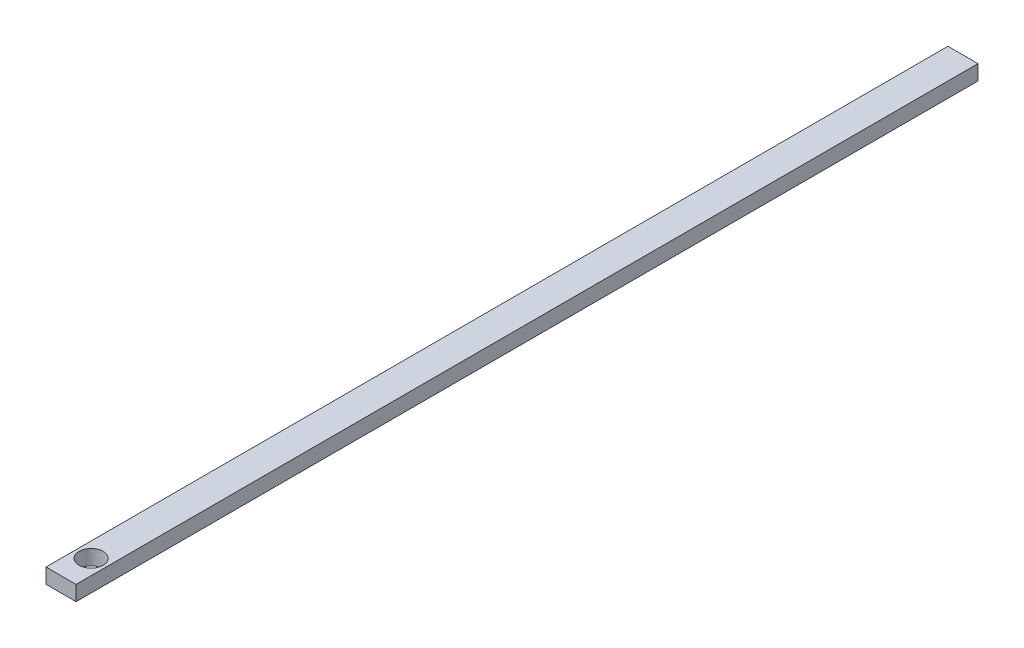
from build123d import *

# Parameters (mm, degrees)
SKETCH1_W           = 300
SKETCH1_H           = 5
BOSS_EXTRUDE1_DEPTH = 10
SKETCH2_R           = 4
CUT_EXTRUDE1_DEPTH  = 151.416089565


with BuildPart() as part:
    # Sketch1 → Boss-Extrude1 (new body)
    with BuildSketch(Plane(origin=(0, 0, 0), x_dir=(0, 0, -1), z_dir=(1, 0, 0))):
        Rectangle(SKETCH1_W, SKETCH1_H)
    extrude(amount=BOSS_EXTRUDE1_DEPTH)

    # Sketch2 → Cut-Extrude1 (cut, through all)
    with BuildSketch(Plane(origin=(0, 2.5, 0), x_dir=(1, 0, 0), z_dir=(0, 1, 0))):
        with Locations(Location((5, -140, 0), (0, 0, 270))):
            Circle(SKETCH2_R)
    extrude(amount=-CUT_EXTRUDE1_DEPTH, mode=Mode.SUBTRACT)


solid = part.part
